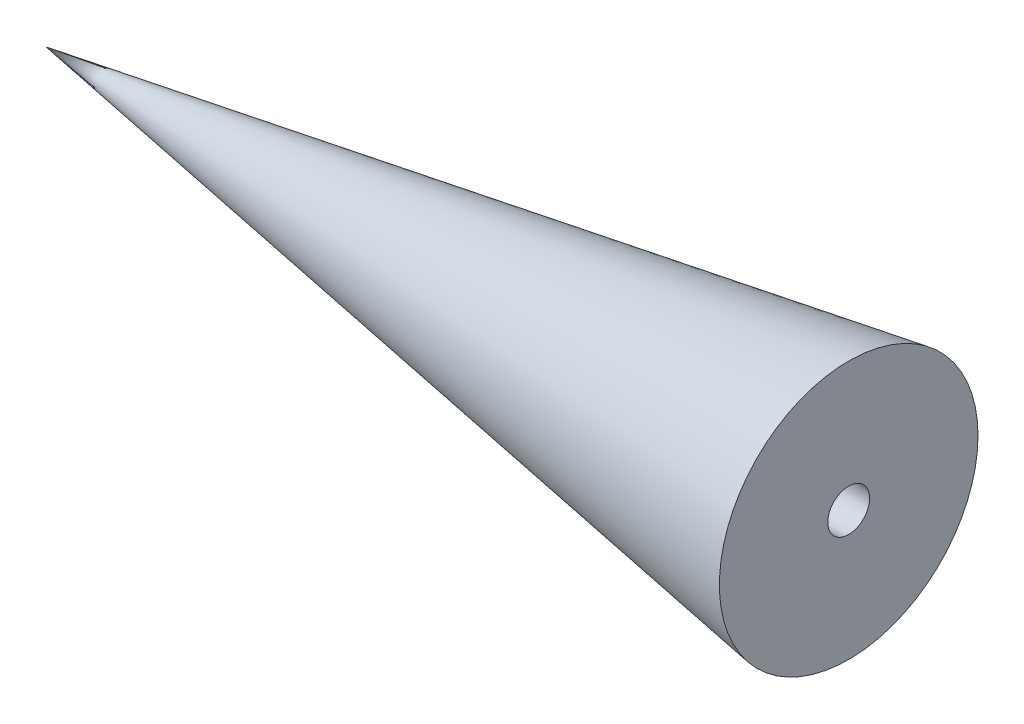
from build123d import *

# Parameters (mm, degrees)
SKETCH2_R          = 3
CUT_EXTRUDE1_DEPTH = 50


with BuildPart() as part:
    # Sketch1 → Revolve1 (revolve)
    with BuildSketch(Plane.XY, mode=Mode.PRIVATE) as revolve1_sk:
        Polygon((0, 0), (0, 18.525), (-115, 0), align=None)
    revolve(revolve1_sk.sketch.rotate(Axis((0, 0, 0), (-1, 0, 0)), 90), axis=Axis((0, 0, 0), (-1, 0, 0)))

    # Sketch2 → Cut-Extrude1 (cut)
    with BuildSketch(Plane(origin=(0, 0, 0), x_dir=(0, 0, -1), z_dir=(1, 0, 0))):
        Circle(SKETCH2_R)
    extrude(amount=-CUT_EXTRUDE1_DEPTH, mode=Mode.SUBTRACT)


solid = part.part
